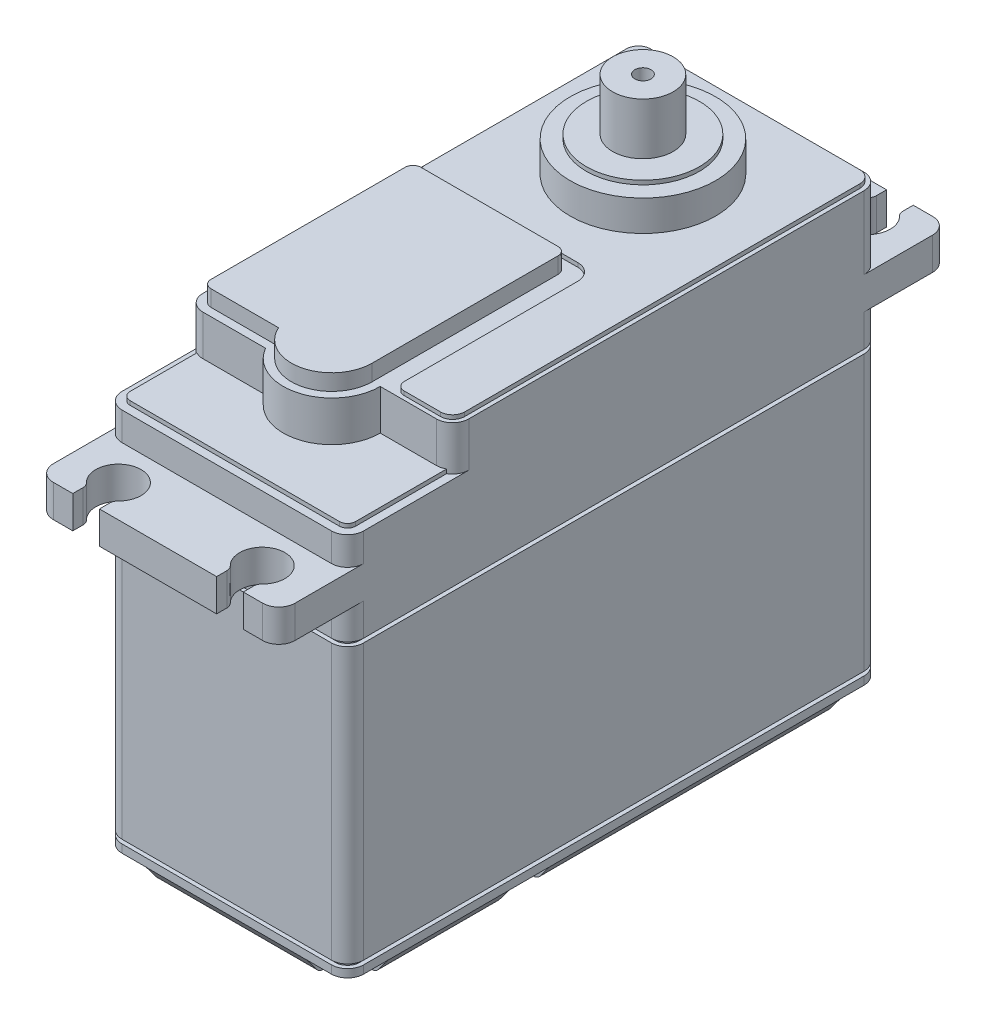
from build123d import *

# Parameters (mm, degrees)
BOSS_EXTRUDE1_DEPTH      = 42
CUT_EXTRUDE1_DEPTH       = 2
CHAMFER1_SIZE            = 1.5
CHAMFER1_SIZE2           = 1.990567232
FILLET1_R                = 1
SKETCH3_R                = 1.5
BOSS_EXTRUDE2_DEPTH      = 1
FILLET2_R                = 0.3
CUT_EXTRUDE2_DEPTH       = 0.5
CUT_EXTRUDE3_DEPTH       = 0.5
CUT_EXTRUDE4_START       = -0.5
CUT_EXTRUDE4_DEPTH       = 0.5
BOSS_EXTRUDE3_DEPTH      = 4
BOSS_EXTRUDE4_DEPTH      = 4
CUT_EXTRUDE5_START       = -0.5
CUT_EXTRUDE5_DEPTH       = 0.5
BOSS_EXTRUDE5_DEPTH      = 5
BOSS_EXTRUDE5_DEPTH_BACK = 2.5
BOSS_EXTRUDE6_DEPTH      = 2
BOSS_EXTRUDE7_DEPTH      = 0.5
SKETCH13_R               = 9
BOSS_EXTRUDE8_DEPTH      = 17.3
SKETCH14_R               = 7
BOSS_EXTRUDE9_DEPTH      = 0.5
SKETCH15_R               = 3.75
BOSS_EXTRUDE10_DEPTH     = 6.4
SKETCH16_R               = 1
CUT_EXTRUDE6_DEPTH       = 6.4
SCALE2_SCALE             = 0.530759952


with BuildPart() as part:
    # Sketch1 → Boss-Extrude1 (new body)
    with BuildSketch(Plane(origin=(0, 0, 0), x_dir=(1, 0, 0), z_dir=(0, 1, 0))):
        with BuildLine():
            Line((12.95, 32.95), (-12.95, 32.95))
            ThreePointArc((-12.95, 32.95), (-14.364213562, 32.364213562), (-14.95, 30.95))
            Line((-14.95, 30.95), (-14.95, -30.95))
            ThreePointArc((-14.95, -30.95), (-14.364213562, -32.364213562), (-12.95, -32.95))
            Line((-12.95, -32.95), (12.95, -32.95))
            ThreePointArc((12.95, -32.95), (14.364213562, -32.364213562), (14.95, -30.95))
            Line((14.95, -30.95), (14.95, 30.95))
            ThreePointArc((14.95, 30.95), (14.364213562, 32.364213562), (12.95, 32.95))
        make_face()
    extrude(amount=BOSS_EXTRUDE1_DEPTH)

    # Sketch2 → Cut-Extrude1 (cut)
    with BuildSketch(Plane.XZ):
        with BuildLine():
            Line((-14.95, -27.95), (-14.95, -32.95))
            Line((-14.95, -32.95), (-9.95, -32.95))
            Line((-9.95, -32.95), (-9.95, -30.45))
            ThreePointArc((-9.95, -30.45), (-10.682233047, -28.682233047), (-12.45, -27.95))
            Line((-12.45, -27.95), (-14.95, -27.95))
        make_face()
        with BuildLine():
            Line((9.95, -30.45), (9.95, -32.95))
            Line((9.95, -32.95), (14.95, -32.95))
            Line((14.95, -32.95), (14.95, -27.95))
            Line((14.95, -27.95), (12.45, -27.95))
            ThreePointArc((12.45, -27.95), (10.682233047, -28.682233047), (9.95, -30.45))
        make_face()
        with BuildLine():
            Line((14.95, 27.95), (14.95, 32.95))
            Line((14.95, 32.95), (9.95, 32.95))
            Line((9.95, 32.95), (9.95, 30.45))
            ThreePointArc((9.95, 30.45), (10.682233047, 28.682233047), (12.45, 27.95))
            Line((12.45, 27.95), (14.95, 27.95))
        make_face()
        with BuildLine():
            Line((-9.95, 30.45), (-9.95, 32.95))
            Line((-9.95, 32.95), (-14.95, 32.95))
            Line((-14.95, 32.95), (-14.95, 27.95))
            Line((-14.95, 27.95), (-12.45, 27.95))
            ThreePointArc((-12.45, 27.95), (-10.682233047, 28.682233047), (-9.95, 30.45))
        make_face()
        with BuildLine():
            Line((-12.45, -5.45), (-14.95, -5.45))
            Line((-14.95, -5.45), (-14.95, -10.45))
            Line((-14.95, -10.45), (-12.45, -10.45))
            ThreePointArc((-12.45, -10.45), (-9.95, -7.95), (-12.45, -5.45))
        make_face()
        with BuildLine():
            Line((12.45, 7.95), (14.95, 7.95))
            Line((14.95, 7.95), (14.95, 12.95))
            Line((14.95, 12.95), (12.45, 12.95))
            ThreePointArc((12.45, 12.95), (9.95, 10.45), (12.45, 7.95))
        make_face()
    extrude(amount=-CUT_EXTRUDE1_DEPTH, mode=Mode.SUBTRACT)

    # Chamfer1
    chamfer1_edges = [part.edges().sort_by_distance(p)[0] for p in [
        (0, 0, -32.95),
        (14.95, 0, 20.45),
        (14.95, 0, -10),
        (0, 0, 32.95),
        (-14.95, 0, -19.2),
        (-14.95, 0, 11.25),
    ]]
    chamfer1_side = [part.faces().sort_by_distance(p)[0] for p in [
        (0, 0, -0.030469374),
    ]]
    chamfer(chamfer1_edges, length=CHAMFER1_SIZE, length2=CHAMFER1_SIZE2, reference=chamfer1_side[0])

    # Fillet1
    fillet1_edges = [part.edges().sort_by_distance(p)[0] for p in [
        (13.45, 0, -10),
        (13.45, 0, 20.45),
        (0, 0, -31.45),
        (-13.45, 0, -19.2),
        (-13.45, 0, 11.25),
        (0, 0, 31.45),
    ]]
    fillet(fillet1_edges, radius=FILLET1_R)

    # Sketch3 → Boss-Extrude2 (add)
    with BuildSketch(Plane.XZ.offset(-2)):
        with Locations(Location((12.45, 30.45, 0), (0, 0, 270))):
            Circle(SKETCH3_R)
        with Locations(Location((12.45, 10.45, 0), (0, 0, 270))):
            Circle(SKETCH3_R)
        with Locations(Location((12.45, -30.45, 0), (0, 0, 90))):
            Circle(SKETCH3_R)
        with Locations(Location((-12.45, -30.45, 0), (0, 0, 270))):
            Circle(SKETCH3_R)
        with Locations(Location((-12.45, -8.151166738, 0), (0, 0, 270))):
            Circle(SKETCH3_R)
        with Locations(Location((-12.45, 30.45, 0), (0, 0, 90))):
            Circle(SKETCH3_R)
    extrude(amount=BOSS_EXTRUDE2_DEPTH)

    # Fillet2
    fillet2_edges = [part.edges().sort_by_distance(p)[0] for p in [
        (12.45, 1, 31.95),
        (12.45, 1, 11.95),
        (12.45, 1, -31.95),
        (-12.45, 1, -28.95),
        (-12.45, 1, -6.651166738),
        (-12.45, 1, 28.95),
    ]]
    fillet(fillet2_edges, radius=FILLET2_R)

    # Sketch4 → Cut-Extrude2 (cut)
    with BuildSketch(Plane(origin=(0, 1, 0), x_dir=(-1, 0, 0), z_dir=(0, -1, 0))):
        with BuildLine():
            ThreePointArc((12.7, -31.725735082), (12.45, -31.75), (12.2, -31.725735082))
            Line((12.2, -31.725735082), (12.2, -30.8))
            ThreePointArc((12.2, -30.8), (12.170710678, -30.729289322), (12.1, -30.7))
            Line((12.1, -30.7), (11.174264918, -30.7))
            ThreePointArc((11.174264918, -30.7), (11.15, -30.45), (11.174264918, -30.2))
            Line((11.174264918, -30.2), (12.1, -30.2))
            ThreePointArc((12.1, -30.2), (12.170710678, -30.170710678), (12.2, -30.1))
            Line((12.2, -30.1), (12.2, -29.174264918))
            ThreePointArc((12.2, -29.174264918), (12.45, -29.15), (12.7, -29.174264918))
            Line((12.7, -29.174264918), (12.7, -30.1))
            ThreePointArc((12.7, -30.1), (12.729289322, -30.170710678), (12.8, -30.2))
            Line((12.8, -30.2), (13.725735082, -30.2))
            ThreePointArc((13.725735082, -30.2), (13.75, -30.45), (13.725735082, -30.7))
            Line((13.725735082, -30.7), (12.8, -30.7))
            ThreePointArc((12.8, -30.7), (12.729289322, -30.729289322), (12.7, -30.8))
            Line((12.7, -30.8), (12.7, -31.725735082))
        make_face()
        with BuildLine():
            Line((11.174264918, 7.901166738), (12.1, 7.901166738))
            ThreePointArc((12.1, 7.901166738), (12.170710678, 7.871877416), (12.2, 7.801166738))
            Line((12.2, 7.801166738), (12.2, 6.875431656))
            ThreePointArc((12.2, 6.875431656), (12.45, 6.851166738), (12.7, 6.875431656))
            Line((12.7, 6.875431656), (12.7, 7.801166738))
            ThreePointArc((12.7, 7.801166738), (12.729289322, 7.871877416), (12.8, 7.901166738))
            Line((12.8, 7.901166738), (13.725735082, 7.901166738))
            ThreePointArc((13.725735082, 7.901166738), (13.75, 8.151166738), (13.725735082, 8.401166738))
            Line((13.725735082, 8.401166738), (12.8, 8.401166738))
            ThreePointArc((12.8, 8.401166738), (12.729289322, 8.43045606), (12.7, 8.501166738))
            Line((12.7, 8.501166738), (12.7, 9.42690182))
            ThreePointArc((12.7, 9.42690182), (12.45, 9.451166738), (12.2, 9.42690182))
            Line((12.2, 9.42690182), (12.2, 8.501166738))
            ThreePointArc((12.2, 8.501166738), (12.170710678, 8.43045606), (12.1, 8.401166738))
            Line((12.1, 8.401166738), (11.174264918, 8.401166738))
            ThreePointArc((11.174264918, 8.401166738), (11.15, 8.151166738), (11.174264918, 7.901166738))
        make_face()
        with BuildLine():
            Line((13.725735082, 30.7), (12.8, 30.7))
            ThreePointArc((12.8, 30.7), (12.729289322, 30.729289322), (12.7, 30.8))
            Line((12.7, 30.8), (12.7, 31.725735082))
            ThreePointArc((12.7, 31.725735082), (12.45, 31.75), (12.2, 31.725735082))
            Line((12.2, 31.725735082), (12.2, 30.8))
            ThreePointArc((12.2, 30.8), (12.170710678, 30.729289322), (12.1, 30.7))
            Line((12.1, 30.7), (11.174264918, 30.7))
            ThreePointArc((11.174264918, 30.7), (11.15, 30.45), (11.174264918, 30.2))
            Line((11.174264918, 30.2), (12.1, 30.2))
            ThreePointArc((12.1, 30.2), (12.170710678, 30.170710678), (12.2, 30.1))
            Line((12.2, 30.1), (12.2, 29.174264918))
            ThreePointArc((12.2, 29.174264918), (12.45, 29.15), (12.7, 29.174264918))
            Line((12.7, 29.174264918), (12.7, 30.1))
            ThreePointArc((12.7, 30.1), (12.729289322, 30.170710678), (12.8, 30.2))
            Line((12.8, 30.2), (13.725735082, 30.2))
            ThreePointArc((13.725735082, 30.2), (13.75, 30.45), (13.725735082, 30.7))
        make_face()
        with BuildLine():
            ThreePointArc((-12.7, 31.725735082), (-12.45, 31.75), (-12.2, 31.725735082))
            Line((-12.2, 31.725735082), (-12.2, 30.8))
            ThreePointArc((-12.2, 30.8), (-12.170710678, 30.729289322), (-12.1, 30.7))
            Line((-12.1, 30.7), (-11.174264918, 30.7))
            ThreePointArc((-11.174264918, 30.7), (-11.15, 30.45), (-11.174264918, 30.2))
            Line((-11.174264918, 30.2), (-12.1, 30.2))
            ThreePointArc((-12.1, 30.2), (-12.170710678, 30.170710678), (-12.2, 30.1))
            Line((-12.2, 30.1), (-12.2, 29.174264918))
            ThreePointArc((-12.2, 29.174264918), (-12.45, 29.15), (-12.7, 29.174264918))
            Line((-12.7, 29.174264918), (-12.7, 30.1))
            ThreePointArc((-12.7, 30.1), (-12.729289322, 30.170710678), (-12.8, 30.2))
            Line((-12.8, 30.2), (-13.725735082, 30.2))
            ThreePointArc((-13.725735082, 30.2), (-13.75, 30.45), (-13.725735082, 30.7))
            Line((-13.725735082, 30.7), (-12.8, 30.7))
            ThreePointArc((-12.8, 30.7), (-12.729289322, 30.729289322), (-12.7, 30.8))
            Line((-12.7, 30.8), (-12.7, 31.725735082))
        make_face()
        with BuildLine():
            Line((-11.174264918, -10.2), (-12.1, -10.2))
            ThreePointArc((-12.1, -10.2), (-12.170710678, -10.170710678), (-12.2, -10.1))
            Line((-12.2, -10.1), (-12.2, -9.174264918))
            ThreePointArc((-12.2, -9.174264918), (-12.45, -9.15), (-12.7, -9.174264918))
            Line((-12.7, -9.174264918), (-12.7, -10.1))
            ThreePointArc((-12.7, -10.1), (-12.729289322, -10.170710678), (-12.8, -10.2))
            Line((-12.8, -10.2), (-13.725735082, -10.2))
            ThreePointArc((-13.725735082, -10.2), (-13.75, -10.45), (-13.725735082, -10.7))
            Line((-13.725735082, -10.7), (-12.8, -10.7))
            ThreePointArc((-12.8, -10.7), (-12.729289322, -10.729289322), (-12.7, -10.8))
            Line((-12.7, -10.8), (-12.7, -11.725735082))
            ThreePointArc((-12.7, -11.725735082), (-12.45, -11.75), (-12.2, -11.725735082))
            Line((-12.2, -11.725735082), (-12.2, -10.8))
            ThreePointArc((-12.2, -10.8), (-12.170710678, -10.729289322), (-12.1, -10.7))
            Line((-12.1, -10.7), (-11.174264918, -10.7))
            ThreePointArc((-11.174264918, -10.7), (-11.15, -10.45), (-11.174264918, -10.2))
        make_face()
        with BuildLine():
            Line((-11.276330541, -30.2), (-12.1, -30.2))
            ThreePointArc((-12.1, -30.2), (-12.170710678, -30.170710678), (-12.2, -30.1))
            Line((-12.2, -30.1), (-12.2, -29.276330541))
            ThreePointArc((-12.2, -29.276330541), (-12.45, -29.25), (-12.7, -29.276330541))
            Line((-12.7, -29.276330541), (-12.7, -30.1))
            ThreePointArc((-12.7, -30.1), (-12.729289322, -30.170710678), (-12.8, -30.2))
            Line((-12.8, -30.2), (-13.623669459, -30.2))
            ThreePointArc((-13.623669459, -30.2), (-13.65, -30.45), (-13.623669459, -30.7))
            Line((-13.623669459, -30.7), (-12.8, -30.7))
            ThreePointArc((-12.8, -30.7), (-12.729289322, -30.729289322), (-12.7, -30.8))
            Line((-12.7, -30.8), (-12.7, -31.623669459))
            ThreePointArc((-12.7, -31.623669459), (-12.45, -31.65), (-12.2, -31.623669459))
            Line((-12.2, -31.623669459), (-12.2, -30.8))
            ThreePointArc((-12.2, -30.8), (-12.170710678, -30.729289322), (-12.1, -30.7))
            Line((-12.1, -30.7), (-11.276330541, -30.7))
            ThreePointArc((-11.276330541, -30.7), (-11.256600789, -30.575691385), (-11.25, -30.45))
            ThreePointArc((-11.25, -30.45), (-11.256600789, -30.324308615), (-11.276330541, -30.2))
        make_face()
    extrude(amount=-CUT_EXTRUDE2_DEPTH, mode=Mode.SUBTRACT)

    # Sketch5 → Cut-Extrude3 (cut)
    with BuildSketch(Plane(origin=(0, 3, 0), x_dir=(-1, 0, 0), z_dir=(0, -1, 0))):
        with BuildLine():
            Line((-14.95, -30.95), (-14.95, 30.95))
            ThreePointArc((-14.95, 30.95), (-14.364213562, 32.364213562), (-12.95, 32.95))
            Line((-12.95, 32.95), (12.95, 32.95))
            ThreePointArc((12.95, 32.95), (14.364213562, 32.364213562), (14.95, 30.95))
            Line((14.95, 30.95), (14.95, -30.95))
            ThreePointArc((14.95, -30.95), (14.364213562, -32.364213562), (12.95, -32.95))
            Line((12.95, -32.95), (-12.95, -32.95))
            ThreePointArc((-12.95, -32.95), (-14.364213562, -32.364213562), (-14.95, -30.95))
        make_face()
        with BuildLine():
            Line((12.95, -32.45), (-12.95, -32.45))
            ThreePointArc((-12.95, -32.45), (-14.010660172, -32.010660172), (-14.45, -30.95))
            Line((-14.45, -30.95), (-14.45, 30.95))
            ThreePointArc((-14.45, 30.95), (-14.010660172, 32.010660172), (-12.95, 32.45))
            Line((-12.95, 32.45), (12.95, 32.45))
            ThreePointArc((12.95, 32.45), (14.010660172, 32.010660172), (14.45, 30.95))
            Line((14.45, 30.95), (14.45, -30.95))
            ThreePointArc((14.45, -30.95), (14.010660172, -32.010660172), (12.95, -32.45))
        make_face(mode=Mode.SUBTRACT)
    extrude(amount=-CUT_EXTRUDE3_DEPTH, mode=Mode.SUBTRACT)

    # Sketch6 → Cut-Extrude4 (cut)
    with BuildSketch(Plane(origin=(0, 38, 0), x_dir=(1, 0, 0), z_dir=(0, 1, 0)).offset(CUT_EXTRUDE4_START)):
        with BuildLine():
            Line((-14.95, 30.95), (-14.95, -30.95))
            ThreePointArc((-14.95, -30.95), (-14.364213562, -32.364213562), (-12.95, -32.95))
            Line((-12.95, -32.95), (12.95, -32.95))
            ThreePointArc((12.95, -32.95), (14.364213562, -32.364213562), (14.95, -30.95))
            Line((14.95, -30.95), (14.95, 30.95))
            ThreePointArc((14.95, 30.95), (14.364213562, 32.364213562), (12.95, 32.95))
            Line((12.95, 32.95), (-12.95, 32.95))
            ThreePointArc((-12.95, 32.95), (-14.364213562, 32.364213562), (-14.95, 30.95))
        make_face()
        with BuildLine():
            Line((-14.45, 30.95), (-14.45, -30.95))
            ThreePointArc((-14.45, -30.95), (-14.010660172, -32.010660172), (-12.95, -32.45))
            Line((-12.95, -32.45), (12.95, -32.45))
            ThreePointArc((12.95, -32.45), (14.010660172, -32.010660172), (14.45, -30.95))
            Line((14.45, -30.95), (14.45, 30.95))
            ThreePointArc((14.45, 30.95), (14.010660172, 32.010660172), (12.95, 32.45))
            Line((12.95, 32.45), (-12.95, 32.45))
            ThreePointArc((-12.95, 32.45), (-14.010660172, 32.010660172), (-14.45, 30.95))
        make_face(mode=Mode.SUBTRACT)
    extrude(amount=CUT_EXTRUDE4_DEPTH, mode=Mode.SUBTRACT)

    # Sketch7 → Boss-Extrude3 (add)
    with BuildSketch(Plane(origin=(0, 42, 0), x_dir=(1, 0, 0), z_dir=(0, 1, 0))):
        with BuildLine():
            Line((7.25, 41.45), (-7.25, 41.45))
            Line((-7.25, 41.45), (-7.25, 40.173508766))
            ThreePointArc((-7.25, 40.173508766), (-7.171240582, 39.784515464), (-6.947368421, 39.456795933))
            ThreePointArc((-6.947368421, 39.456795933), (-8.9, 34.65), (-10.852631579, 39.456795933))
            ThreePointArc((-10.852631579, 39.456795933), (-10.628759418, 39.784515464), (-10.55, 40.173508766))
            Line((-10.55, 40.173508766), (-10.55, 41.45))
            Line((-10.55, 41.45), (-12.95, 41.45))
            ThreePointArc((-12.95, 41.45), (-14.364213562, 40.864213562), (-14.95, 39.45))
            Line((-14.95, 39.45), (-14.95, -39.45))
            ThreePointArc((-14.95, -39.45), (-14.364213562, -40.864213562), (-12.95, -41.45))
            Line((-12.95, -41.45), (-10.55, -41.45))
            Line((-10.55, -41.45), (-10.55, -40.173508766))
            ThreePointArc((-10.55, -40.173508766), (-10.628759418, -39.784515464), (-10.852631579, -39.456795933))
            ThreePointArc((-10.852631579, -39.456795933), (-8.9, -34.65), (-6.947368421, -39.456795933))
            ThreePointArc((-6.947368421, -39.456795933), (-7.171240582, -39.784515464), (-7.25, -40.173508766))
            Line((-7.25, -40.173508766), (-7.25, -41.45))
            Line((-7.25, -41.45), (7.25, -41.45))
            Line((7.25, -41.45), (7.25, -40.173508766))
            ThreePointArc((7.25, -40.173508766), (7.171240582, -39.784515464), (6.947368421, -39.456795933))
            ThreePointArc((6.947368421, -39.456795933), (8.9, -34.65), (10.852631579, -39.456795933))
            ThreePointArc((10.852631579, -39.456795933), (10.628759418, -39.784515464), (10.55, -40.173508766))
            Line((10.55, -40.173508766), (10.55, -41.45))
            Line((10.55, -41.45), (12.95, -41.45))
            ThreePointArc((12.95, -41.45), (14.364213562, -40.864213562), (14.95, -39.45))
            Line((14.95, -39.45), (14.95, 39.45))
            ThreePointArc((14.95, 39.45), (14.364213562, 40.864213562), (12.95, 41.45))
            Line((12.95, 41.45), (10.55, 41.45))
            Line((10.55, 41.45), (10.55, 40.173508766))
            ThreePointArc((10.55, 40.173508766), (10.628759418, 39.784515464), (10.852631579, 39.456795933))
            ThreePointArc((10.852631579, 39.456795933), (8.9, 34.65), (6.947368421, 39.456795933))
            ThreePointArc((6.947368421, 39.456795933), (7.171240582, 39.784515464), (7.25, 40.173508766))
            Line((7.25, 40.173508766), (7.25, 41.45))
        make_face()
    extrude(amount=BOSS_EXTRUDE3_DEPTH)

    # Sketch8 → Boss-Extrude4 (add)
    with BuildSketch(Plane(origin=(0, 46, 0), x_dir=(1, 0, 0), z_dir=(0, 1, 0))):
        with BuildLine():
            Line((-12.95, 32.95), (12.95, 32.95))
            ThreePointArc((12.95, 32.95), (14.364213562, 32.364213562), (14.95, 30.95))
            Line((14.95, 30.95), (14.95, -30.95))
            ThreePointArc((14.95, -30.95), (14.364213562, -32.364213562), (12.95, -32.95))
            Line((12.95, -32.95), (-12.95, -32.95))
            ThreePointArc((-12.95, -32.95), (-14.364213562, -32.364213562), (-14.95, -30.95))
            Line((-14.95, -30.95), (-14.95, 30.95))
            ThreePointArc((-14.95, 30.95), (-14.364213562, 32.364213562), (-12.95, 32.95))
        make_face()
    extrude(amount=BOSS_EXTRUDE4_DEPTH)

    # Sketch9 → Cut-Extrude5 (cut)
    with BuildSketch(Plane(origin=(0, 50, 0), x_dir=(1, 0, 0), z_dir=(0, 1, 0)).offset(CUT_EXTRUDE5_START)):
        with BuildLine():
            Line((-12.95, -32.95), (12.95, -32.95))
            ThreePointArc((12.95, -32.95), (14.364213562, -32.364213562), (14.95, -30.95))
            Line((14.95, -30.95), (14.95, 30.95))
            ThreePointArc((14.95, 30.95), (14.364213562, 32.364213562), (12.95, 32.95))
            Line((12.95, 32.95), (-12.95, 32.95))
            ThreePointArc((-12.95, 32.95), (-14.364213562, 32.364213562), (-14.95, 30.95))
            Line((-14.95, 30.95), (-14.95, -30.95))
            ThreePointArc((-14.95, -30.95), (-14.364213562, -32.364213562), (-12.95, -32.95))
        make_face()
        with BuildLine():
            Line((-12.95, -31.95), (12.95, -31.95))
            ThreePointArc((12.95, -31.95), (13.657106781, -31.657106781), (13.95, -30.95))
            Line((13.95, -30.95), (13.95, 30.95))
            ThreePointArc((13.95, 30.95), (13.657106781, 31.657106781), (12.95, 31.95))
            Line((12.95, 31.95), (-12.95, 31.95))
            ThreePointArc((-12.95, 31.95), (-13.657106781, 31.657106781), (-13.95, 30.95))
            Line((-13.95, 30.95), (-13.95, -30.95))
            ThreePointArc((-13.95, -30.95), (-13.657106781, -31.657106781), (-12.95, -31.95))
        make_face(mode=Mode.SUBTRACT)
    extrude(amount=CUT_EXTRUDE5_DEPTH, mode=Mode.SUBTRACT)

    # Sketch10 → Boss-Extrude5 (add, two sides: drawn at the far end of the back side and taken through both)
    with BuildSketch(Plane(origin=(0, 50, 0), x_dir=(1, 0, 0), z_dir=(0, 1, 0)).offset(-BOSS_EXTRUDE5_DEPTH_BACK)):
        with BuildLine():
            Line((12.95, -19.95), (6, -19.95))
            ThreePointArc((6, -19.95), (1.552914271, -25.745554958), (-5.196152423, -22.95))
            Line((-5.196152423, -22.95), (-12.95, -22.95))
            ThreePointArc((-12.95, -22.95), (-14.364213562, -22.364213562), (-14.95, -20.95))
            Line((-14.95, -20.95), (-14.95, 30.95))
            ThreePointArc((-14.95, 30.95), (-14.364213562, 32.364213562), (-12.95, 32.95))
            Line((-12.95, 32.95), (12.95, 32.95))
            ThreePointArc((12.95, 32.95), (14.364213562, 32.364213562), (14.95, 30.95))
            Line((14.95, 30.95), (14.95, -17.95))
            ThreePointArc((14.95, -17.95), (14.364213562, -19.364213562), (12.95, -19.95))
        make_face()
    extrude(amount=BOSS_EXTRUDE5_DEPTH + BOSS_EXTRUDE5_DEPTH_BACK)

    # Sketch11 → Boss-Extrude6 (add)
    with BuildSketch(Plane(origin=(0, 55, 0), x_dir=(1, 0, 0), z_dir=(0, 1, 0))):
        with BuildLine():
            Line((5, -19.95), (5, 3.05))
            ThreePointArc((5, 3.05), (4.707106781, 3.757106781), (4, 4.05))
            Line((4, 4.05), (-12.95, 4.05))
            ThreePointArc((-12.95, 4.05), (-13.657106781, 3.757106781), (-13.95, 3.05))
            Line((-13.95, 3.05), (-13.95, -20.95))
            ThreePointArc((-13.95, -20.95), (-13.657106781, -21.657106781), (-12.95, -21.95))
            Line((-12.95, -21.95), (-4.582575695, -21.95))
            ThreePointArc((-4.582575695, -21.95), (1.021548218, -24.844531565), (5, -19.95))
        make_face()
    extrude(amount=BOSS_EXTRUDE6_DEPTH)

    # Sketch12 → Boss-Extrude7 (add)
    with BuildSketch(Plane(origin=(0, 55, 0), x_dir=(1, 0, 0), z_dir=(0, 1, 0))):
        with BuildLine():
            Line((7.45, -18.45), (7.45, 3.045428577))
            ThreePointArc((7.45, 3.045428577), (6.862598245, 4.461255614), (5.445433802, 5.045423365))
            Line((5.445433802, 5.045423365), (-13.447716901, 5.002288318))
            ThreePointArc((-13.447716901, 5.002288318), (-14.156299123, 5.294372193), (-14.45, 6.002285711))
            Line((-14.45, 6.002285711), (-14.45, 30.95))
            ThreePointArc((-14.45, 30.95), (-14.010660172, 32.010660172), (-12.95, 32.45))
            Line((-12.95, 32.45), (12.95, 32.45))
            ThreePointArc((12.95, 32.45), (14.010660172, 32.010660172), (14.45, 30.95))
            Line((14.45, 30.95), (14.45, -17.95))
            ThreePointArc((14.45, -17.95), (14.010660172, -19.010660172), (12.95, -19.45))
            Line((12.95, -19.45), (8.45, -19.45))
            ThreePointArc((8.45, -19.45), (7.742893219, -19.157106781), (7.45, -18.45))
        make_face()
    extrude(amount=BOSS_EXTRUDE7_DEPTH)

    # Sketch13 → Boss-Extrude8 (add)
    with BuildSketch(Plane(origin=(0, 42, 0), x_dir=(1, 0, 0), z_dir=(0, 1, 0))):
        with Locations(Location((0, 18.55, 0), (0, 0, 270))):
            Circle(SKETCH13_R)
    extrude(amount=BOSS_EXTRUDE8_DEPTH)

    # Sketch14 → Boss-Extrude9 (add)
    with BuildSketch(Plane(origin=(0, 59.3, 0), x_dir=(1, 0, 0), z_dir=(0, 1, 0))):
        with Locations(Location((0, 18.55, 0), (0, 0, 270))):
            Circle(SKETCH14_R)
    extrude(amount=BOSS_EXTRUDE9_DEPTH)

    # Sketch15 → Boss-Extrude10 (add)
    with BuildSketch(Plane(origin=(0, 59.8, 0), x_dir=(1, 0, 0), z_dir=(0, 1, 0))):
        with Locations(Location((0, 18.55, 0), (0, 0, 270))):
            Circle(SKETCH15_R)
    extrude(amount=BOSS_EXTRUDE10_DEPTH)

    # Sketch16 → Cut-Extrude6 (cut)
    with BuildSketch(Plane(origin=(0, 66.2, 0), x_dir=(1, 0, 0), z_dir=(0, 1, 0))):
        with Locations(Location((0, 18.55, 0), (0, 0, 270))):
            Circle(SKETCH16_R)
    extrude(amount=-CUT_EXTRUDE6_DEPTH, mode=Mode.SUBTRACT)


with BuildPart() as part_1:
    # Scale2: scaled about (-0.044488737, 28.253165173, -0.580564371)
    add(part.part.scale(SCALE2_SCALE).moved(Location((-0.020875897, 13.257516589, -0.272424053))))


solid = part_1.part
